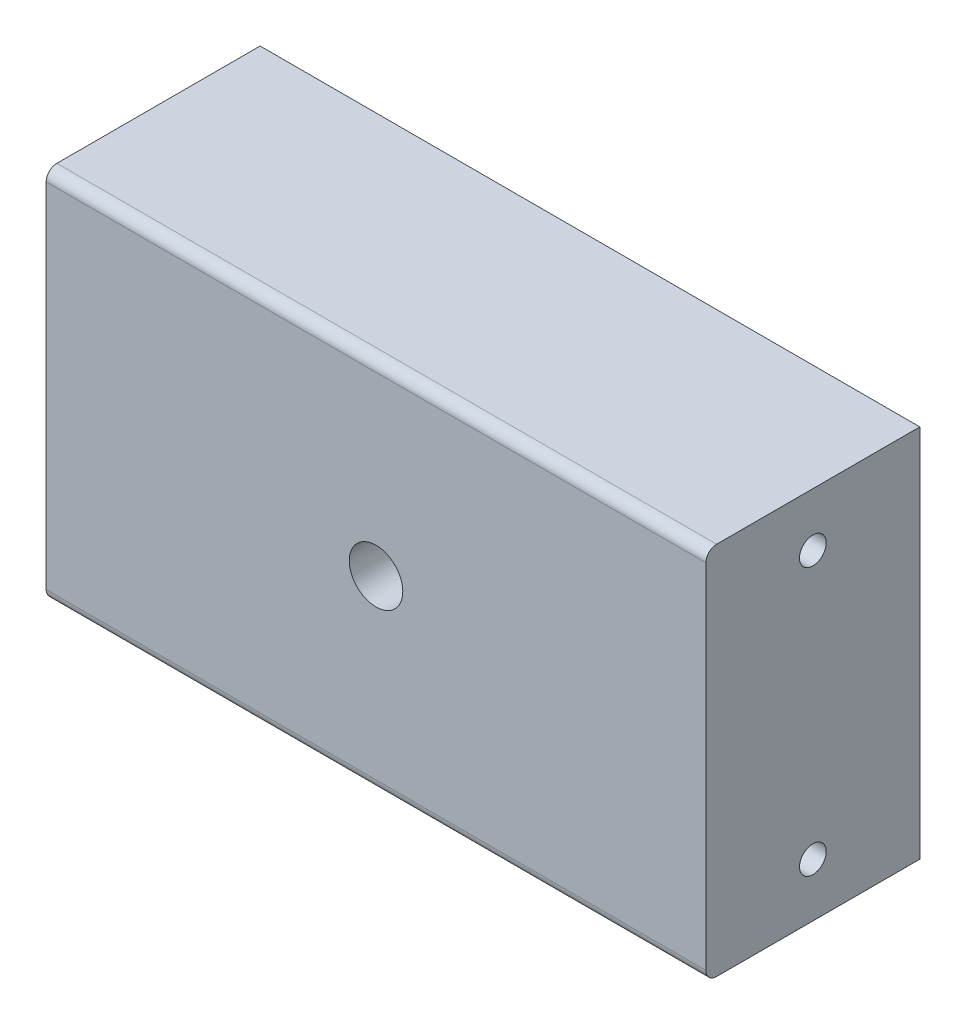
from build123d import *

# Parameters (mm, degrees)
SKETCH2_W                            = 61.675
SKETCH2_H                            = 35
BOSS_EXTRUDE1_DEPTH                  = 20
TAP_DRILL_FOR_M6X1_0_TAP1_D          = 5
TAP_DRILL_FOR_M3X0_5_TAP1_AT_2_COUNT = 2
TAP_DRILL_FOR_M3X0_5_TAP1_AT_2_PITCH = 25
FILLET1_R                            = 1


with BuildPart() as part:
    # Sketch2 → Boss-Extrude1 (new body)
    with BuildSketch(Plane.XY):
        Rectangle(SKETCH2_W, SKETCH2_H)
    extrude(amount=-BOSS_EXTRUDE1_DEPTH)

    # Tap Drill for M6x1.0 Tap1 (through all)
    with Locations(Plane.XY):
        with Locations((0, 0)):
            Hole(TAP_DRILL_FOR_M6X1_0_TAP1_D / 2)

    # Sketch6 → Tap Drill for M3x0.5 Tap1 (revolve, cut)
    with BuildSketch(Plane(origin=(30.8375, 12.5, -10), x_dir=(0, 0, -1), z_dir=(0, 1, 0))):
        Polygon((0, 0), (0, 8.251075774), (1.25, 7.5), (1.25, 0), align=None)
    tap_drill_for_m3x0_5_tap1 = revolve(axis=Axis((37.1875, 12.5, -10), (-1, 0, 0)), mode=Mode.SUBTRACT)

    # Tap Drill for M3x0.5 Tap1 at 2: Tap Drill for M3x0.5 Tap1 ×2
    with Locations(*[(0, -i * TAP_DRILL_FOR_M3X0_5_TAP1_AT_2_PITCH, 0) for i in range(1, TAP_DRILL_FOR_M3X0_5_TAP1_AT_2_COUNT)]):
        add(tap_drill_for_m3x0_5_tap1, mode=Mode.SUBTRACT)

    # Mirror1: Tap Drill for M3x0.5 Tap1 across plane
    add(tap_drill_for_m3x0_5_tap1.mirror(Plane(origin=(0, 0, 0), x_dir=(0, 0, 1), z_dir=(1, 0, 0))), mode=Mode.SUBTRACT)

    # Mirror1 copy 1 sketch → Mirror1 copy 1 (revolve, cut)
    with BuildSketch(Plane(origin=(-30.8375, -12.5, -10), x_dir=(0, 0, -1), z_dir=(0, 1, 0))):
        Polygon((0, 0), (0, -8.251075774), (1.25, -7.5), (1.25, 0), align=None)
    revolve(axis=Axis((-37.1875, -12.5, -10), (-1, 0, 0)), mode=Mode.SUBTRACT)

    # Fillet1
    fillet1_edges = [part.edges().sort_by_distance(p)[0] for p in [
        (0, 17.5, 0),
        (0, -17.5, 0),
    ]]
    fillet(fillet1_edges, radius=FILLET1_R)


solid = part.part
